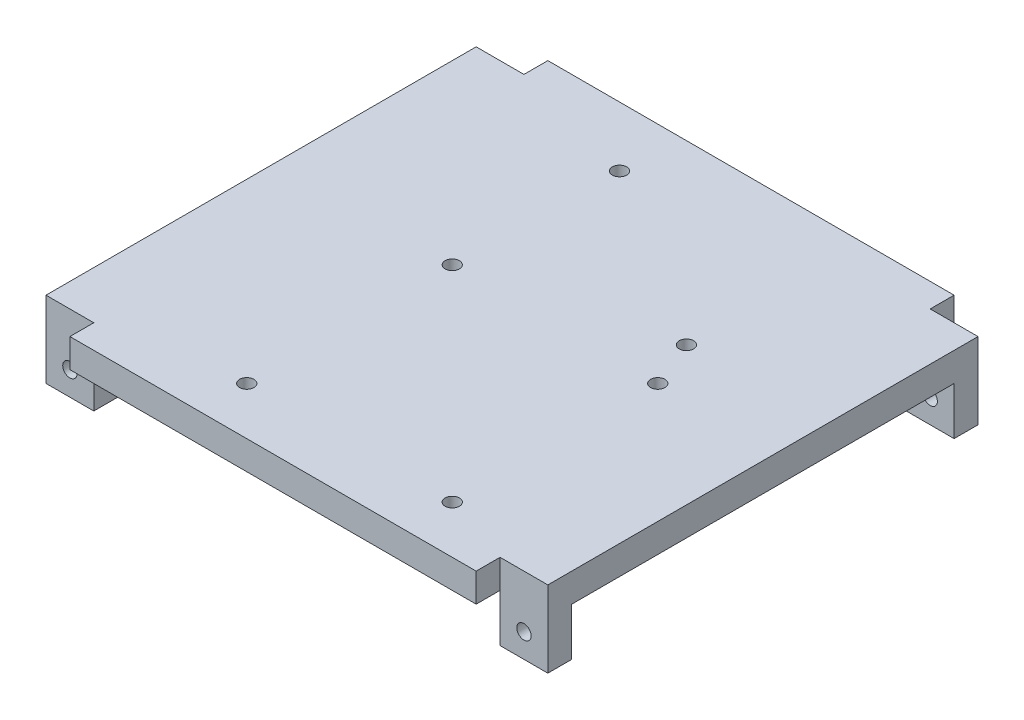
from build123d import *

# Parameters (mm, degrees)
SKETCH1_W           = 105
SKETCH1_H           = 100
BOSS_EXTRUDE1_DEPTH = 6
SKETCH2_W           = 10
SKETCH2_H           = 5
CUT_EXTRUDE1_DEPTH  = 10
SKETCH3_W           = 10
SKETCH3_H           = 5
BOSS_EXTRUDE2_DEPTH = 10
SKETCH4_R           = 1.5
CUT_EXTRUDE2_DEPTH  = 142.950695666
SKETCH5_R           = 1.5
CUT_EXTRUDE4_DEPTH  = 6
SKETCH6_R           = 1.5
CUT_EXTRUDE5_DEPTH  = 6


with BuildPart() as part:
    # Sketch1 → Boss-Extrude1 (new body)
    with BuildSketch(Plane(origin=(0, 0, 0), x_dir=(1, 0, 0), z_dir=(0, 1, 0))):
        with Locations((52.5, 50)):
            Rectangle(SKETCH1_W, SKETCH1_H)
    extrude(amount=BOSS_EXTRUDE1_DEPTH)

    # Sketch2 → Cut-Extrude1 (cut)
    with BuildSketch(Plane.XZ):
        with Locations((100, -97.5)):
            Rectangle(SKETCH2_W, SKETCH2_H)
        with Locations((5, -97.5)):
            Rectangle(SKETCH2_W, SKETCH2_H)
        with Locations((100, -2.5)):
            Rectangle(SKETCH2_W, SKETCH2_H)
        with Locations((5, -2.5)):
            Rectangle(SKETCH2_W, SKETCH2_H)
    extrude(amount=-CUT_EXTRUDE1_DEPTH, mode=Mode.SUBTRACT)

    # Sketch3 → Boss-Extrude2 (add)
    with BuildSketch(Plane(origin=(0, 0, 0), x_dir=(-1, 0, 0), z_dir=(0, -1, 0))):
        with Locations((-100, 92.5)):
            Rectangle(SKETCH3_W, SKETCH3_H)
        with Locations((-100, 7.5)):
            Rectangle(SKETCH3_W, SKETCH3_H)
        with Locations((-5, 7.5)):
            Rectangle(SKETCH3_W, SKETCH3_H)
        with Locations((-5, 92.5)):
            Rectangle(SKETCH3_W, SKETCH3_H)
    extrude(amount=BOSS_EXTRUDE2_DEPTH)

    # Sketch4 → Cut-Extrude2 (cut, through all)
    with BuildSketch(Plane(origin=(0, 0, -95), x_dir=(-1, 0, 0), z_dir=(0, 0, -1))):
        with Locations((-100, -5)):
            Circle(SKETCH4_R)
        with Locations((-5, -5)):
            Circle(SKETCH4_R)
    extrude(amount=-CUT_EXTRUDE2_DEPTH, mode=Mode.SUBTRACT)

    # Sketch5 → Cut-Extrude4 (cut)
    with BuildSketch(Plane(origin=(0, 0, 0), x_dir=(-1, 0, 0), z_dir=(0, -1, 0))):
        with Locations(Location((-37, 10, 0), (0, 0, 90))):
            Circle(SKETCH5_R)
        with Locations(Location((-37, 53, 0), (0, 0, 90))):
            Circle(SKETCH5_R)
        with Locations(Location((-80, 53, 0), (0, 0, 90))):
            Circle(SKETCH5_R)
        with Locations(Location((-80, 10, 0), (0, 0, 90))):
            Circle(SKETCH5_R)
    extrude(amount=-CUT_EXTRUDE4_DEPTH, mode=Mode.SUBTRACT)

    # Sketch6 → Cut-Extrude5 (cut)
    with BuildSketch(Plane(origin=(0, 0, 0), x_dir=(-1, 0, 0), z_dir=(0, -1, 0))):
        with Locations(Location((-37.5, 87.5, 0), (0, 0, 90))):
            Circle(SKETCH6_R)
        with Locations(Location((-76, 63, 0), (0, 0, 90))):
            Circle(SKETCH6_R)
    extrude(amount=-CUT_EXTRUDE5_DEPTH, mode=Mode.SUBTRACT)


solid = part.part
